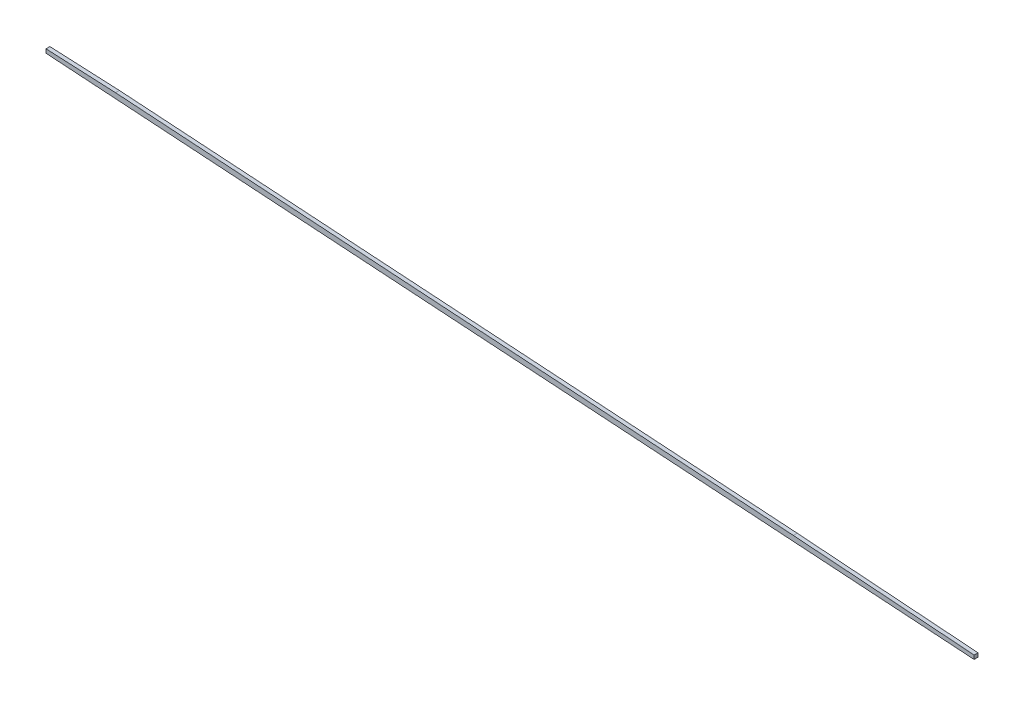
from build123d import *

# Parameters (mm, degrees)
EXTRUDE_1_DEPTH = 3


with BuildPart() as part:
    # Model → 凸台-拉伸1 (new body)
    with BuildSketch(Plane.XY):
        Polygon((-576.258316645, 73.563688345), (-532.418521463, 70.685265019), (-516.387228291, 69.632686008), (-472.54743311, 66.754262682), (-356.730992682, 59.15001311), (-163.213476617, 46.444083941), (142.473244876, 26.373374529), (142.502115467, 29.373235607), (2.495537439, 39.565038713), (-372.762285854, 64.203631744), (-466.494654663, 70.357890352), (-522.440006738, 74.031137586), (-576.258316645, 76.563688345), align=None)
    extrude(amount=EXTRUDE_1_DEPTH)


solid = part.part
